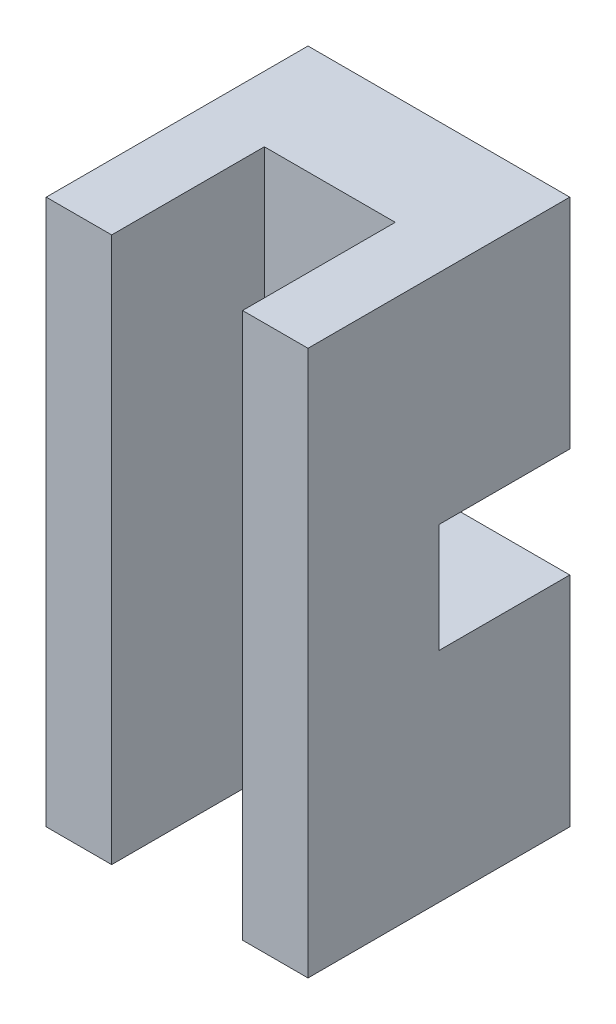
from build123d import *

# Parameters (mm, degrees)
BOSS_EXTRUDE1_DEPTH = 30
SKETCH2_W           = 30
SKETCH2_H           = 35
CUT_EXTRUDE1_DEPTH  = 133.003787824
SKETCH3_R           = 5
CUT_EXTRUDE2_DEPTH  = 78.661122835


with BuildPart() as part:
    # Sketch1 → Boss-Extrude1 (new, symmetric)
    with BuildSketch(Plane.YZ):
        Polygon((-62.5, 30), (-62.5, -30), (-12.5, -30), (-12.5, 0), (12.5, 0), (12.5, -30), (62.5, -30), (62.5, 30), align=None)
    extrude(amount=BOSS_EXTRUDE1_DEPTH, both=True)

    # Sketch2 → Cut-Extrude1 (cut, through all)
    with BuildSketch(Plane(origin=(0, 62.5, 0), x_dir=(-1, 0, 0), z_dir=(0, 1, 0))):
        with Locations((0, 12.5)):
            Rectangle(SKETCH2_W, SKETCH2_H)
    extrude(amount=-CUT_EXTRUDE1_DEPTH, mode=Mode.SUBTRACT)

    # Sketch3 → Cut-Extrude2 (cut, through all)
    with BuildSketch(Plane.XY.offset(-5)):
        with Locations((0, -37.5)):
            Circle(SKETCH3_R)
        with Locations((0, 37.5)):
            Circle(SKETCH3_R)
    extrude(amount=-CUT_EXTRUDE2_DEPTH, mode=Mode.SUBTRACT)


solid = part.part
